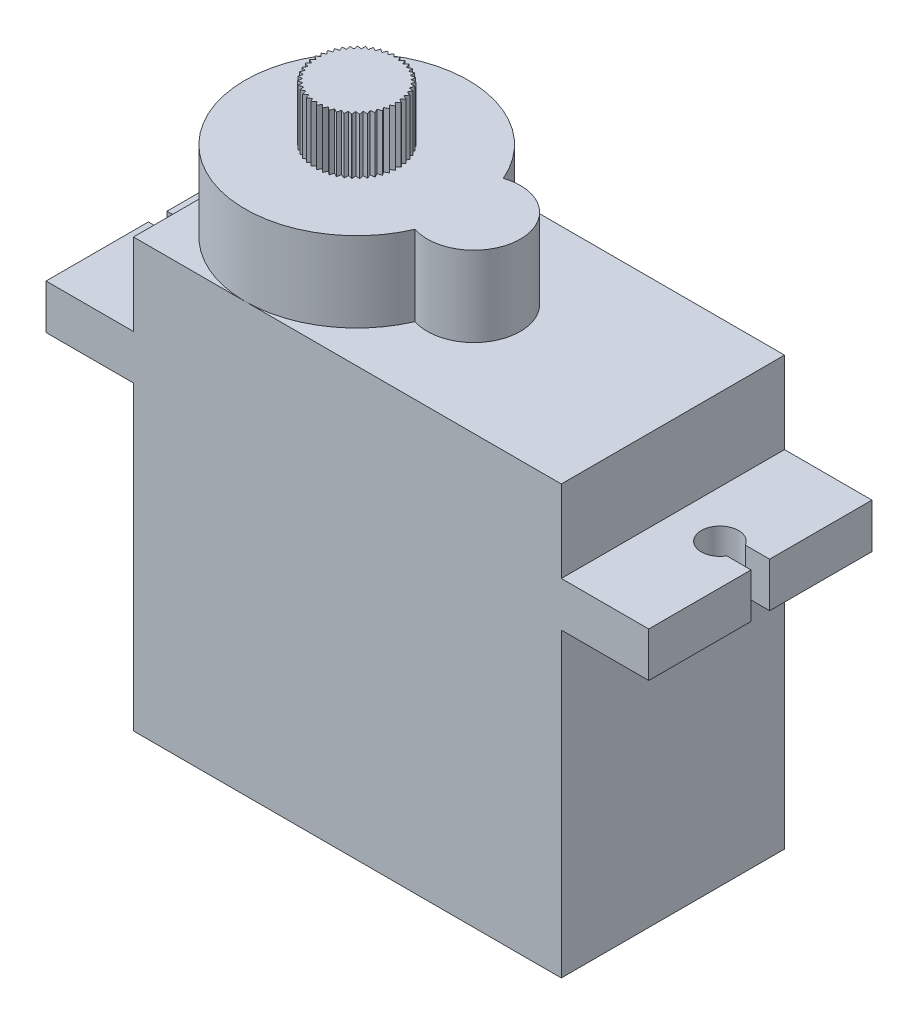
from build123d import *

# Parameters (mm, degrees)
SKETCH2_W           = 23
SKETCH2_H           = 12
BOSS_EXTRUDE1_DEPTH = 23
BOSS_EXTRUDE2_START = -4.4
BOSS_EXTRUDE2_DEPTH = 2.4
BOSS_EXTRUDE3_DEPTH = 4.3
BOSS_EXTRUDE4_DEPTH = 3
SKETCH6_W           = 3
SKETCH6_H           = 1
BOSS_EXTRUDE5_DEPTH = 3


with BuildPart() as part:
    # Sketch2 → Boss-Extrude1 (new body)
    with BuildSketch(Plane(origin=(0, 0, 0), x_dir=(1, 0, 0), z_dir=(0, 1, 0))):
        Rectangle(SKETCH2_W, SKETCH2_H)
    extrude(amount=-BOSS_EXTRUDE1_DEPTH)

    # Sketch3 → Boss-Extrude2 (add)
    with BuildSketch(Plane(origin=(0, 0, 0), x_dir=(1, 0, 0), z_dir=(0, 1, 0)).offset(BOSS_EXTRUDE2_START)):
        with BuildLine():
            Line((-16.2, -0.5), (-16.2, -6))
            Line((-16.2, -6), (-11.5, -6))
            Line((-11.5, -6), (-11.5, 6))
            Line((-11.5, 6), (-16.2, 6))
            Line((-16.2, 6), (-16.2, 0.5))
            Line((-16.2, 0.5), (-15.584293743, 0.5))
            ThreePointArc((-15.584293743, 0.5), (-14.459449294, 0.965925826), (-13.718268339, 0))
            ThreePointArc((-13.718268339, 0), (-14.459449294, -0.965925826), (-15.584293743, -0.5))
            Line((-15.584293743, -0.5), (-16.2, -0.5))
        make_face()
        with BuildLine():
            Line((11.5, 6), (11.5, -6))
            Line((11.5, -6), (16.2, -6))
            Line((16.2, -6), (16.2, -0.5))
            Line((16.2, -0.5), (14.894380034, -0.5))
            ThreePointArc((14.894380034, -0.5), (13.02835463, 0), (14.894380034, 0.5))
            Line((14.894380034, 0.5), (16.2, 0.5))
            Line((16.2, 0.5), (16.2, 6))
            Line((16.2, 6), (11.5, 6))
        make_face()
    extrude(amount=-BOSS_EXTRUDE2_DEPTH)

    # Sketch4 → Boss-Extrude3 (add)
    with BuildSketch(Plane(origin=(0, 0, 0), x_dir=(1, 0, 0), z_dir=(0, 1, 0))):
        with BuildLine():
            ThreePointArc((0.011111111, -2.372267759), (2.262494065, -2.02758751), (3.3, 0))
            Line((3.3, 0), (0.5, 0))
            ThreePointArc((0.5, 0), (0.376506899, -1.211060142), (0.011111111, -2.372267759))
        make_face()
        with BuildLine():
            Line((0.5, 0), (3.3, 0))
            ThreePointArc((3.3, 0), (2.262494065, 2.02758751), (0.011111111, 2.372267759))
            ThreePointArc((0.011111111, 2.372267759), (0.376506899, 1.211060142), (0.5, 0))
        make_face()
        with BuildLine():
            ThreePointArc((0.011111111, -2.372267759), (0.376506899, -1.211060142), (0.5, 0))
            Line((0.5, 0), (-1.7, 0))
            ThreePointArc((-1.7, 0), (-1.22758751, -1.462494065), (0.011111111, -2.372267759))
        make_face()
        with BuildLine():
            Line((-1.7, 0), (0.5, 0))
            ThreePointArc((0.5, 0), (0.376506899, 1.211060142), (0.011111111, 2.372267759))
            ThreePointArc((0.011111111, 2.372267759), (-1.22758751, 1.462494065), (-1.7, 0))
        make_face()
        with BuildLine():
            ThreePointArc((-1.7, 0), (-1.22758751, 1.462494065), (0.011111111, 2.372267759))
            ThreePointArc((0.011111111, 2.372267759), (-6.711060142, 5.876506899), (-11.5, 0))
            Line((-11.5, 0), (-1.7, 0))
        make_face()
        with BuildLine():
            ThreePointArc((-11.5, 0), (-6.711060142, -5.876506899), (0.011111111, -2.372267759))
            ThreePointArc((0.011111111, -2.372267759), (-1.22758751, -1.462494065), (-1.7, 0))
            Line((-1.7, 0), (-11.5, 0))
        make_face()
    extrude(amount=BOSS_EXTRUDE3_DEPTH)

    # Sketch5 → Boss-Extrude4 (add)
    with BuildSketch(Plane(origin=(0, 4.3, 0), x_dir=(1, 0, 0), z_dir=(0, 1, 0))):
        Polygon((-3.255005568, -0.15), (-3.437184296, 0), (-3.255005568, 0.15), (-3.455589794, 0.274946425), (-3.295142762, 0.44844683), (-3.51047784, 0.544986424), (-3.374587739, 0.738324266), (-3.600868956, 0.805301127), (-3.491960749, 1.015026288), (-3.725150111, 1.051245213), (-3.645167266, 1.273615142), (-3.881103504, 1.278429803), (-3.831473318, 1.509476304), (-4.065946143, 1.482800783), (-4.047554268, 1.718400825), (-4.276379508, 1.660711148), (-4.289554146, 1.896660443), (-4.508648409, 1.808986083), (-4.553154459, 2.04107411), (-4.758608002, 1.924979619), (-4.833651254, 2.149064761), (-5.021797754, 2.006621847), (-5.126039057, 2.218705301), (-5.293521035, 2.052455862), (-5.425100203, 2.248752992), (-5.568928939, 2.061663752), (-5.725497937, 2.238671633), (-5.843106805, 2.034081205), (-6.021871655, 2.188641125), (-6.111161921, 1.97020043), (-6.308932561, 2.099554265), (-6.368310838, 1.871161381), (-6.581558046, 1.973000809), (-6.609964728, 1.738731414), (-6.834883102, 1.811239107), (-6.831811271, 1.575273743), (-7.064387138, 1.6171558), (-7.02989161, 1.383705275), (-7.265974648, 1.39421431), (-7.200670997, 1.167444554), (-7.436048299, 1.146393032), (-7.34110187, 0.930350756), (-7.571573122, 0.878114343), (-7.448678237, 0.676654828), (-7.670130674, 0.594165683), (-7.521480394, 0.410883978), (-7.729962192, 0.299614123), (-7.558209186, 0.137780894), (-7.749999982, -0.000284059), (-7.558209186, -0.137780894), (-7.729886469, -0.300177172), (-7.521480394, -0.410883978), (-7.669980579, -0.594713616), (-7.448678237, -0.676654828), (-7.571351335, -0.878637381), (-7.34110187, -0.930350756), (-7.435758777, -1.146881842), (-7.200670997, -1.167444554), (-7.265622557, -1.394660168), (-7.02989161, -1.383705275), (-7.063978761, -1.617550752), (-6.831811271, -1.575273743), (-6.834425728, -1.811576103), (-6.609964728, -1.738731414), (-6.581059835, -1.973273836), (-6.368310838, -1.871161381), (-6.308402404, -2.099758451), (-6.111161921, -1.97020043), (-6.021319013, -2.188772827), (-5.843106805, -2.034081205), (-5.724932672, -2.238728499), (-5.568928939, -2.061663752), (-5.424532402, -2.248734009), (-5.293521035, -2.052455862), (-5.125478853, -2.218610806), (-5.021797754, -2.006621847), (-4.833108643, -2.148896442), (-4.758608002, -1.924979619), (-4.552639125, -2.040834969), (-4.508648409, -1.808986083), (-4.289075284, -1.896354748), (-4.276379508, -1.660711148), (-4.047120423, -1.718034032), (-4.065946143, -1.482800783), (-3.831092233, -1.509054958), (-3.881103504, -1.278429803), (-3.644845742, -1.273146762), (-3.725150111, -1.051245213), (-3.491704522, -1.014519232), (-3.600868956, -0.805301127), (-3.374401382, -0.737787582), (-3.51047784, -0.544986424), (-3.295029601, -0.447890096), (-3.455589794, -0.274946425), align=None)
    extrude(amount=BOSS_EXTRUDE4_DEPTH)

    # Sketch6 → Boss-Extrude5 (add)
    with BuildSketch(Plane.ZY.offset(11.5)):
        with Locations((0, -17.5)):
            Rectangle(SKETCH6_W, SKETCH6_H)
    extrude(amount=BOSS_EXTRUDE5_DEPTH)


solid = part.part
